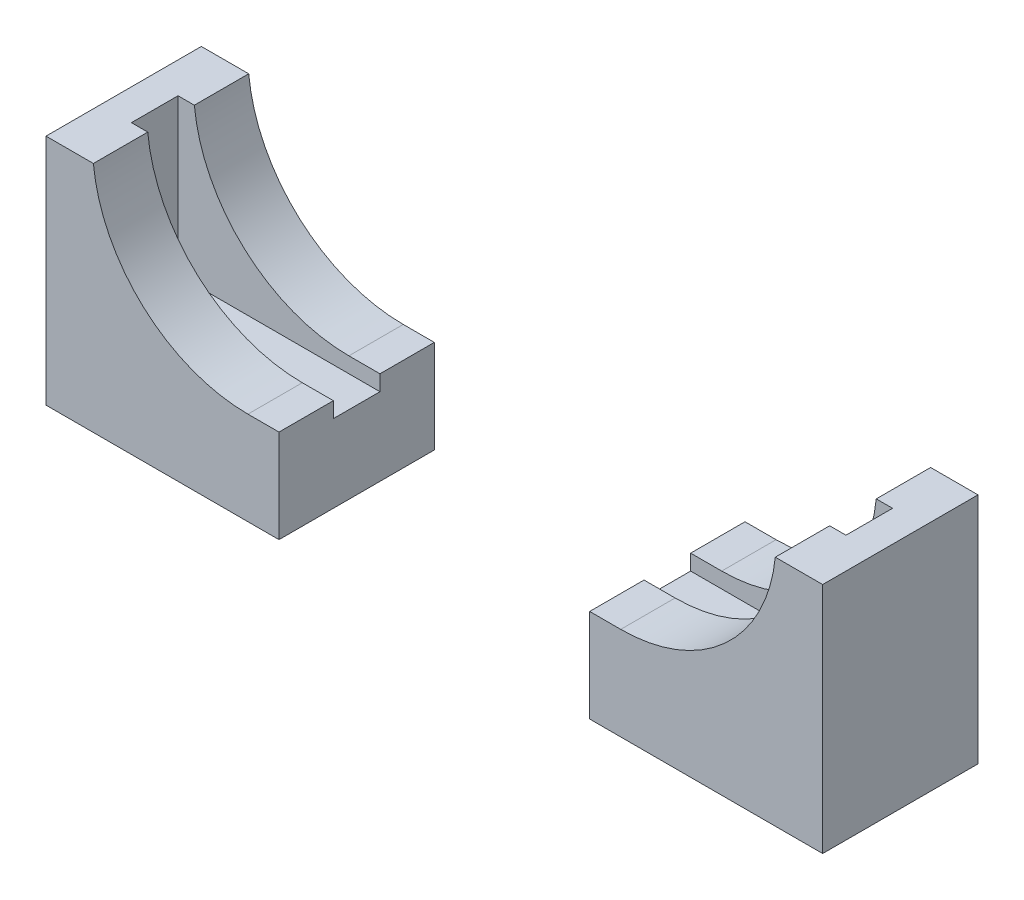
from build123d import *

# Parameters (mm, degrees)
SKETCH1_W           = 50
SKETCH1_H           = 10
BOSS_EXTRUDE1_DEPTH = 15
SKETCH3_W           = 46
SKETCH3_H           = 3
CUT_EXTRUDE1_DEPTH  = 10
CUT_EXTRUDE2_DEPTH  = 10


with BuildPart() as part:
    # Sketch1 → Boss-Extrude1 (new body)
    with BuildSketch(Plane(origin=(0, 0, 0), x_dir=(1, 0, 0), z_dir=(0, 1, 0))):
        Rectangle(SKETCH1_W, SKETCH1_H)
    extrude(amount=BOSS_EXTRUDE1_DEPTH)

    # Sketch3 → Cut-Extrude1 (cut)
    with BuildSketch(Plane(origin=(0, 15, 0), x_dir=(1, 0, 0), z_dir=(0, 1, 0))):
        Rectangle(SKETCH3_W, SKETCH3_H)
    extrude(amount=-CUT_EXTRUDE1_DEPTH, mode=Mode.SUBTRACT)

    # Sketch4 → Cut-Extrude2 (cut)
    with BuildSketch(Plane.XY.offset(5)):
        with BuildLine():
            Line((-10, 6), (-10, 0))
            Line((-10, 0), (10, 0))
            Line((10, 0), (10, 6))
            Line((10, 6), (12, 6))
            ThreePointArc((12, 6), (18.708203932, 8.583801513), (21.949874371, 15))
            Line((21.949874371, 15), (-21.949874371, 15))
            ThreePointArc((-21.949874371, 15), (-18.708203932, 8.583801513), (-12, 6))
            Line((-12, 6), (-10, 6))
        make_face()
    extrude(amount=-CUT_EXTRUDE2_DEPTH, mode=Mode.SUBTRACT)


with BuildPart() as cut_extrude2_piece_1:
    # of the separate pieces the step leaves, piece 1, a body of its own (cut_extrude2_pieces)
    add(part.part.solids().sort_by_distance((-25, 0, 5))[0])


with BuildPart() as cut_extrude2_piece_2:
    # of the separate pieces the step leaves, piece 2, a body of its own (cut_extrude2_pieces)
    add(part.part.solids().sort_by_distance((10, 0, 5))[0])


solid = Compound([cut_extrude2_piece_1.part, cut_extrude2_piece_2.part])
